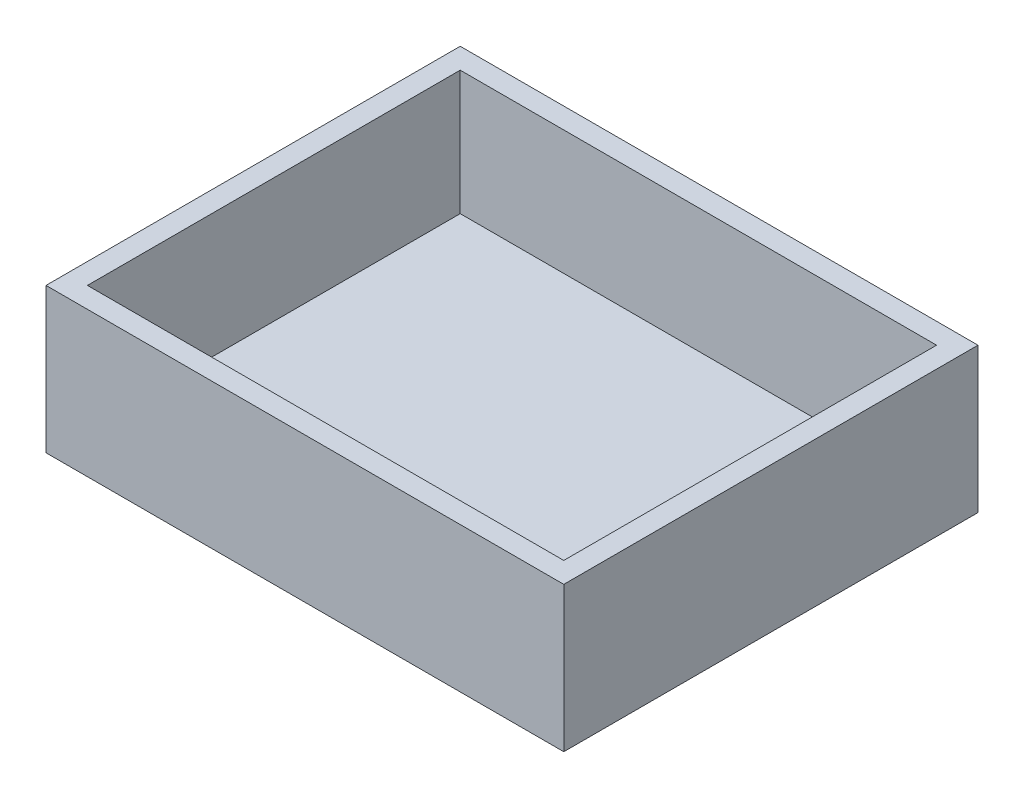
from build123d import *

# Parameters (mm, degrees)
CROQUIS1_W              = 250
CROQUIS1_H              = 200
SALIENTE_EXTRUIR1_DEPTH = 10
CROQUIS2_W              = 250
CROQUIS2_H              = 200
CROQUIS2_W_2            = 230
CROQUIS2_H_2            = 180
SALIENTE_EXTRUIR2_DEPTH = 60


with BuildPart() as part:
    # Croquis1 → Saliente-Extruir1 (new body)
    with BuildSketch(Plane(origin=(0, 0, 0), x_dir=(1, 0, 0), z_dir=(0, 1, 0))):
        Rectangle(CROQUIS1_W, CROQUIS1_H)
    extrude(amount=SALIENTE_EXTRUIR1_DEPTH)

    # Croquis2 → Saliente-Extruir2 (add)
    with BuildSketch(Plane(origin=(0, 10, 0), x_dir=(1, 0, 0), z_dir=(0, 1, 0))):
        Rectangle(CROQUIS2_W, CROQUIS2_H)
        Rectangle(CROQUIS2_W_2, CROQUIS2_H_2, mode=Mode.SUBTRACT)
    extrude(amount=SALIENTE_EXTRUIR2_DEPTH)


solid = part.part
